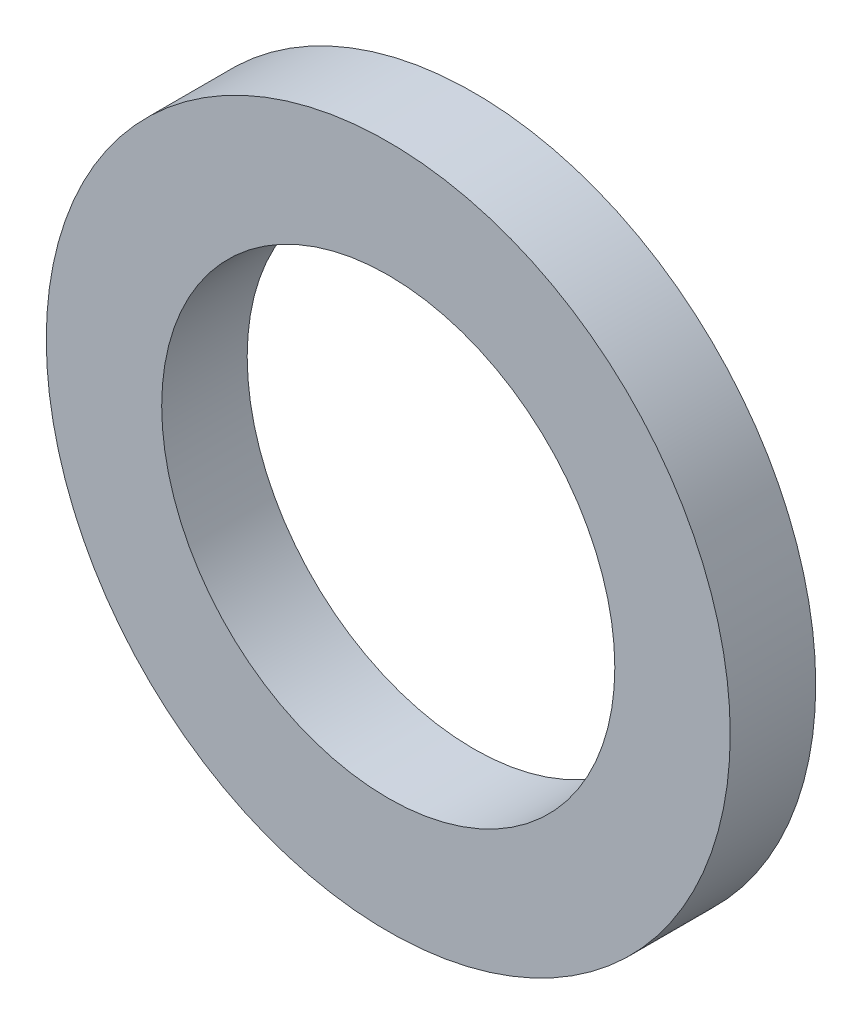
from build123d import *

# Parameters (mm, degrees)
CROQUIS1_R              = 4
CROQUIS1_R_2            = 2.65
SALIENTE_EXTRUIR1_DEPTH = 1


with BuildPart() as part:
    # Croquis1 → Saliente-Extruir1 (new body)
    with BuildSketch(Plane.XY):
        Circle(CROQUIS1_R)
        Circle(CROQUIS1_R_2, mode=Mode.SUBTRACT)
    extrude(amount=SALIENTE_EXTRUIR1_DEPTH)


solid = part.part
